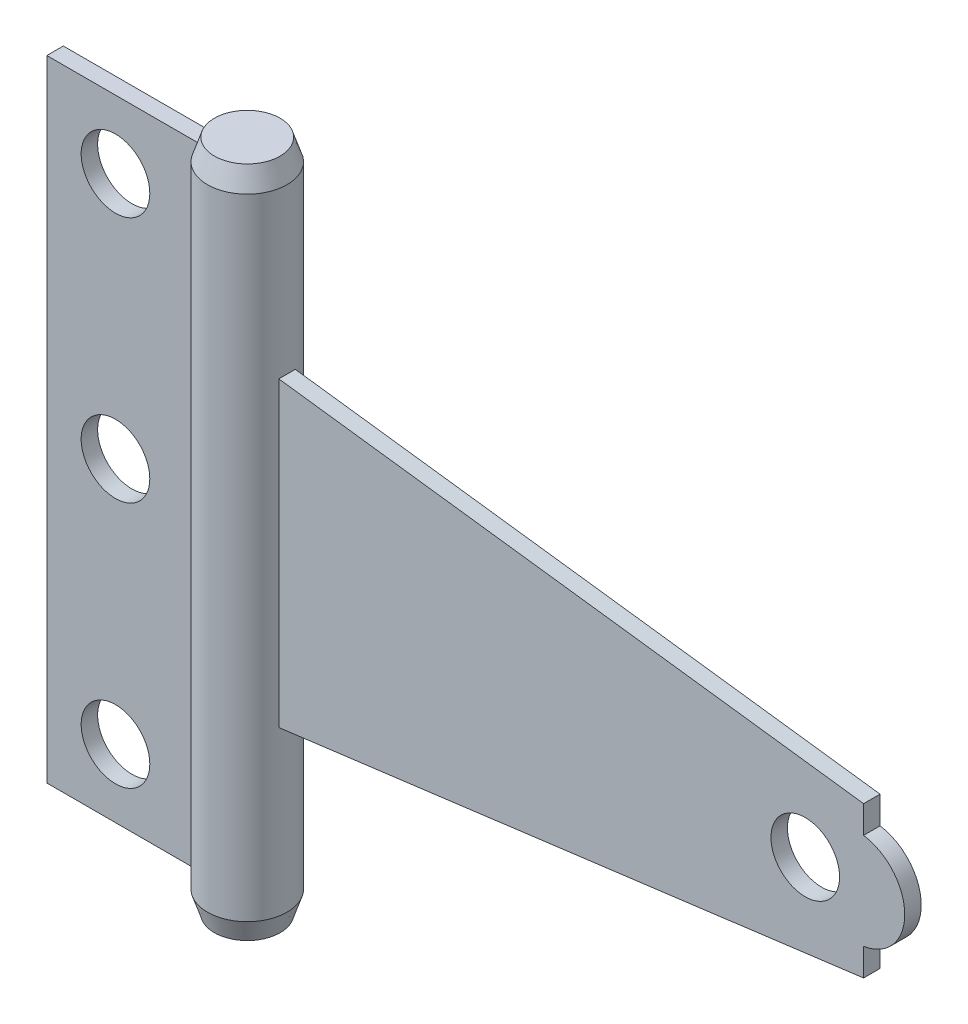
from build123d import *

# Parameters (mm, degrees)
SKETCH1_R             = 2.5
BOSS_EXTRUDE1_DEPTH   = 0.6
SKETCH1_W             = 11.1
SKETCH1_H             = 45.9
BOSS_EXTRUDE1_2_DEPTH = 0.6


with BuildPart() as part:
    # Sketch1 → Boss-Extrude1 (new, symmetric)
    with BuildSketch(Plane.XY):
        with BuildLine():
            Line((45.5, 5.5), (2.9, 11))
            Line((2.9, 11), (2.9, -11))
            Line((2.9, -11), (45.5, -5.5))
            Line((45.5, -5.5), (45.5, -3.5))
            ThreePointArc((45.5, -3.5), (48.5, 0), (45.5, 3.5))
            Line((45.5, 3.5), (45.5, 5.5))
        make_face()
        with Locations((41.25, 0)):
            Circle(SKETCH1_R, mode=Mode.SUBTRACT)
    extrude(amount=BOSS_EXTRUDE1_DEPTH, both=True)


with BuildPart() as body_2:
    # Sketch1 → Boss-Extrude1 2 (new, symmetric)
    with BuildSketch(Plane.XY):
        with Locations((-8.45, 0)):
            Rectangle(SKETCH1_W, SKETCH1_H)
        with Locations((-9, -18)):
            Circle(SKETCH1_R, mode=Mode.SUBTRACT)
        with Locations((-9, 0)):
            Circle(SKETCH1_R, mode=Mode.SUBTRACT)
        with Locations((-9, 18)):
            Circle(SKETCH1_R, mode=Mode.SUBTRACT)
    extrude(amount=BOSS_EXTRUDE1_2_DEPTH, both=True)


with BuildPart() as body_3:
    # Sketch1<5> → Revolve1 (revolve)
    with BuildSketch(Plane.XY):
        Polygon((2.9, 22.95), (2.393991589, 24.5), (0, 24.5), (0, -24.5), (2.393991589, -24.5), (2.9, -22.95), (2.9, -11), (2.9, 11), align=None)
    revolve(axis=Axis((0, 0, 0), (0, 1, 0)))


solid = Compound([part.part, body_2.part, body_3.part])
